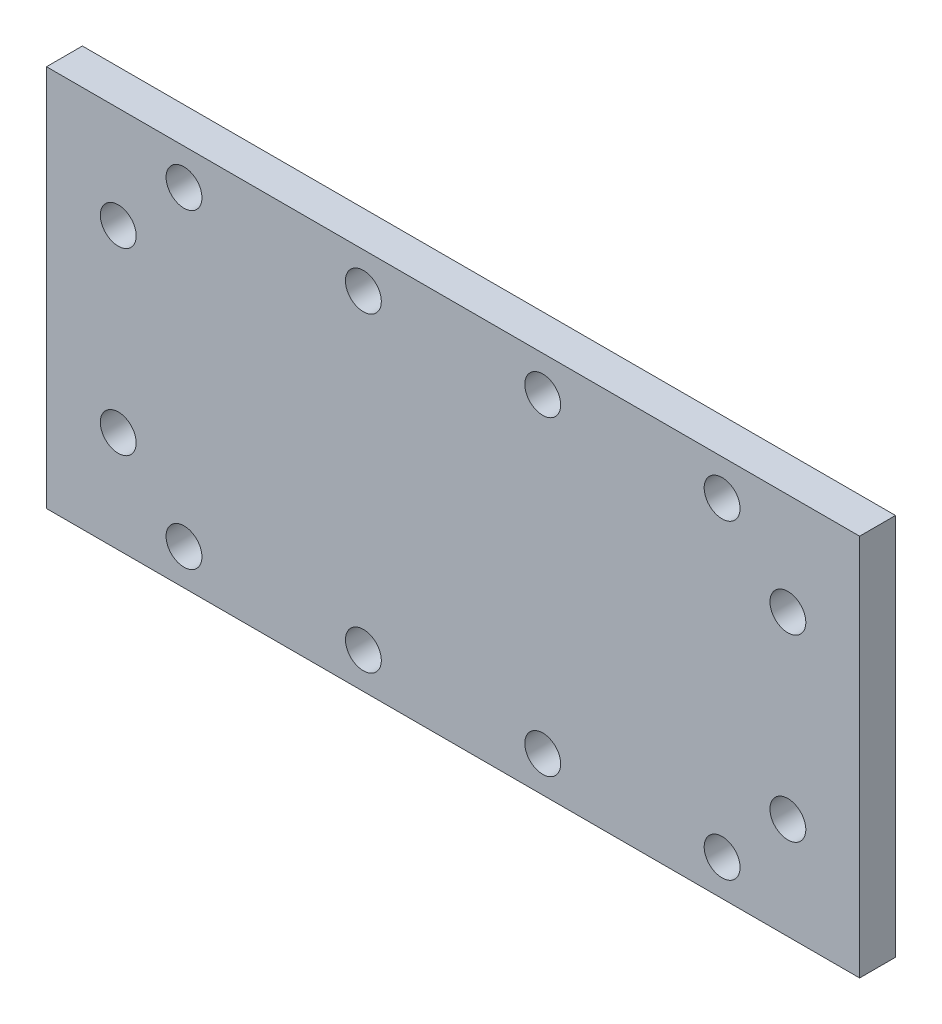
from build123d import *

# Parameters (mm, degrees)
SKETCH1_W           = 68
SKETCH1_H           = 32
BOSS_EXTRUDE1_DEPTH = 3
SKETCH2_R           = 1.5
CUT_EXTRUDE1_DEPTH  = 38.69615365


with BuildPart() as part:
    # Sketch1 → Boss-Extrude1 (new body)
    with BuildSketch(Plane.XY):
        Rectangle(SKETCH1_W, SKETCH1_H)
    extrude(amount=BOSS_EXTRUDE1_DEPTH)

    # Sketch2 → Cut-Extrude1 (cut, through all)
    with BuildSketch(Plane.XY.offset(3)):
        with Locations((-22.5, 13)):
            Circle(SKETCH2_R)
        with Locations((-7.5, 13)):
            Circle(SKETCH2_R)
        with Locations((7.5, 13)):
            Circle(SKETCH2_R)
        with Locations((22.5, 13)):
            Circle(SKETCH2_R)
        with Locations(Location((-22.5, -13, 0), (0, 0, 180))):
            Circle(SKETCH2_R)
        with Locations(Location((22.5, -13, 0), (0, 0, 180))):
            Circle(SKETCH2_R)
        with Locations(Location((7.5, -13, 0), (0, 0, 180))):
            Circle(SKETCH2_R)
        with Locations(Location((-7.5, -13, 0), (0, 0, 180))):
            Circle(SKETCH2_R)
        with Locations((-28, 7.5)):
            Circle(SKETCH2_R)
        with Locations((-28, -7.5)):
            Circle(SKETCH2_R)
        with Locations(Location((28, -7.5, 0), (0, 0, 180))):
            Circle(SKETCH2_R)
        with Locations(Location((28, 7.5, 0), (0, 0, 180))):
            Circle(SKETCH2_R)
    extrude(amount=-CUT_EXTRUDE1_DEPTH, mode=Mode.SUBTRACT)


solid = part.part
